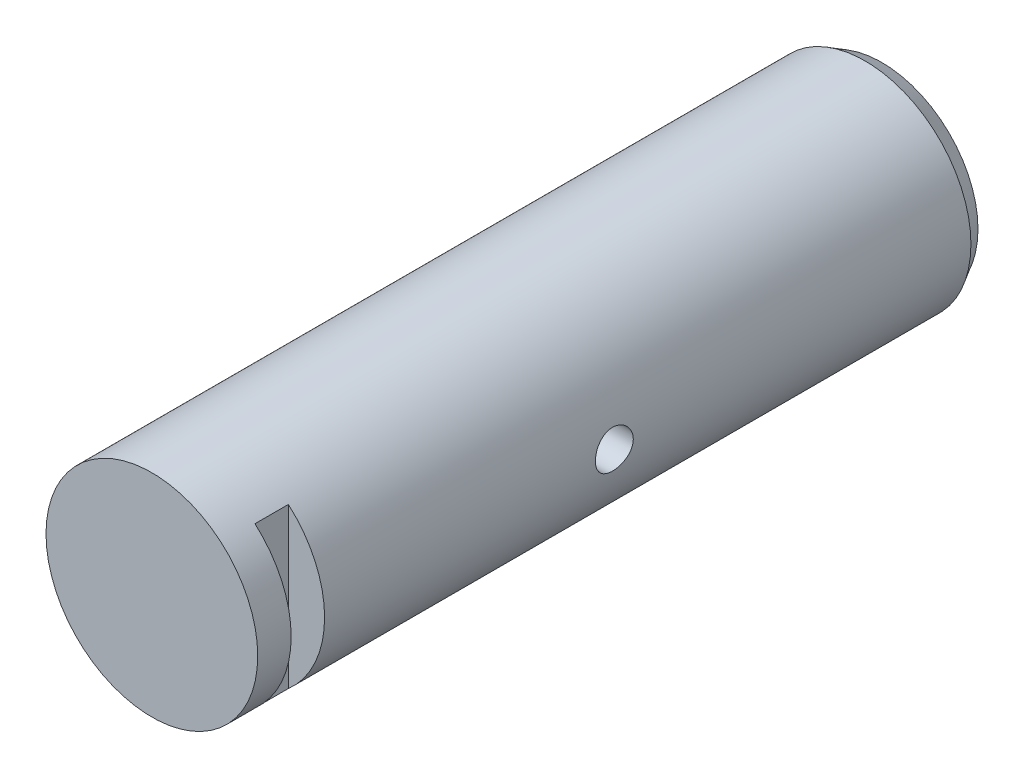
from build123d import *

# Parameters (mm, degrees)
AUFSATZ_LINEAR_AUSTRAGEN1_DEPTH      = 75
AUFSATZ_LINEAR_AUSTRAGEN1_DEPTH_BACK = 56
SKIZZE1_R                            = 19
M8_TAPPED_HOLE1_D                    = 6.8
M8_TAPPED_HOLE1_DEPTH                = 75
M8_TAPPED_HOLE1_TIP                  = 2.042926105
SKIZZE7_W                            = 3.4
SKIZZE7_H                            = 19
CHAMFER1_SIZE                        = 3
CHAMFER1_SIZE2                       = 1.732050808
CUT_EXTRUDE2_DEPTH                   = 80.668061496
CUT_EXTRUDE2_DEPTH_BACK              = 80.668061496
SKETCH2_W                            = 6.5
SKETCH2_H                            = 6


with BuildPart() as part:
    # Skizze1 → Aufsatz-Linear austragen1 (new, two sides: drawn at the far end of the back side and taken through both)
    with BuildSketch(Plane.XY.offset(-AUFSATZ_LINEAR_AUSTRAGEN1_DEPTH_BACK)):
        Circle(SKIZZE1_R)
    extrude(amount=AUFSATZ_LINEAR_AUSTRAGEN1_DEPTH + AUFSATZ_LINEAR_AUSTRAGEN1_DEPTH_BACK)

    # M8 Tapped Hole1
    with Locations(Plane(origin=(0, 0, -56), x_dir=(-1, 0, 0), z_dir=(0, 0, -1))):
        with Locations((0, 0)):
            Hole(M8_TAPPED_HOLE1_D / 2, depth=M8_TAPPED_HOLE1_DEPTH)
            with Locations((0, 0, -(M8_TAPPED_HOLE1_DEPTH + M8_TAPPED_HOLE1_TIP / 2))):  # 118° drill point
                Cone(0, M8_TAPPED_HOLE1_D / 2, M8_TAPPED_HOLE1_TIP, mode=Mode.SUBTRACT)

    # Skizze7 → Tap Drill for M8 Tap1 (revolve, cut)
    with BuildSketch(Plane(origin=(0, 0, 11), x_dir=(0, 0, 1), z_dir=(0, 1, 0))):
        with Locations((1.7, 9.5)):
            Rectangle(SKIZZE7_W, SKIZZE7_H)
    tap_drill_for_m8_tap1 = revolve(axis=Axis((-6.35, 0, 11), (1, 0, 0)), mode=Mode.SUBTRACT)

    # Spiegeln1: Tap Drill for M8 Tap1 across plane
    add(tap_drill_for_m8_tap1.mirror(Plane(origin=(0, 0, 0), x_dir=(0, 0, 1), z_dir=(1, 0, 0))), mode=Mode.SUBTRACT)

    # Chamfer1
    chamfer1_edges = [part.edges().sort_by_distance(p)[0] for p in [
        (-19, 0, -56),
    ]]
    chamfer1_side = [part.faces().sort_by_distance(p)[0] for p in [
        (-19, 0, -28),
    ]]
    chamfer(chamfer1_edges, length=CHAMFER1_SIZE, length2=CHAMFER1_SIZE2, reference=chamfer1_side[0])

    # Sketch2 → Cut-Extrude2 (cut, two sides: drawn at the far end of the back side and taken through both)
    with BuildSketch(Plane(origin=(0, 0, 0), x_dir=(1, 0, 0), z_dir=(0, 1, 0)).offset(-CUT_EXTRUDE2_DEPTH_BACK)):
        with Locations((15.75, -66)):
            Rectangle(SKETCH2_W, SKETCH2_H)
    extrude(amount=CUT_EXTRUDE2_DEPTH + CUT_EXTRUDE2_DEPTH_BACK, mode=Mode.SUBTRACT)


solid = part.part
